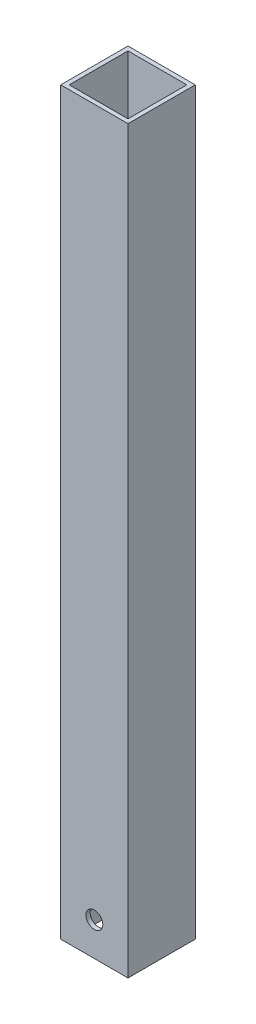
from build123d import *

# Parameters (mm, degrees)
SKETCH1_W           = 25.4
SKETCH1_H           = 25.4
SKETCH1_W_2         = 22.225
SKETCH1_H_2         = 22.225
BOSS_EXTRUDE1_DEPTH = 279.4
SKETCH2_R           = 3.175
CUT_EXTRUDE1_DEPTH  = 25.4


with BuildPart() as part:
    # Sketch1 → Boss-Extrude1 (new body)
    with BuildSketch(Plane(origin=(0, 0, 0), x_dir=(1, 0, 0), z_dir=(0, 1, 0))):
        Rectangle(SKETCH1_W, SKETCH1_H)
        Rectangle(SKETCH1_W_2, SKETCH1_H_2, mode=Mode.SUBTRACT)
    extrude(amount=BOSS_EXTRUDE1_DEPTH)

    # Sketch2 → Cut-Extrude1 (cut)
    with BuildSketch(Plane.XY.offset(12.7)):
        with Locations((0, 12.7)):
            Circle(SKETCH2_R)
    extrude(amount=-CUT_EXTRUDE1_DEPTH, mode=Mode.SUBTRACT)


solid = part.part
